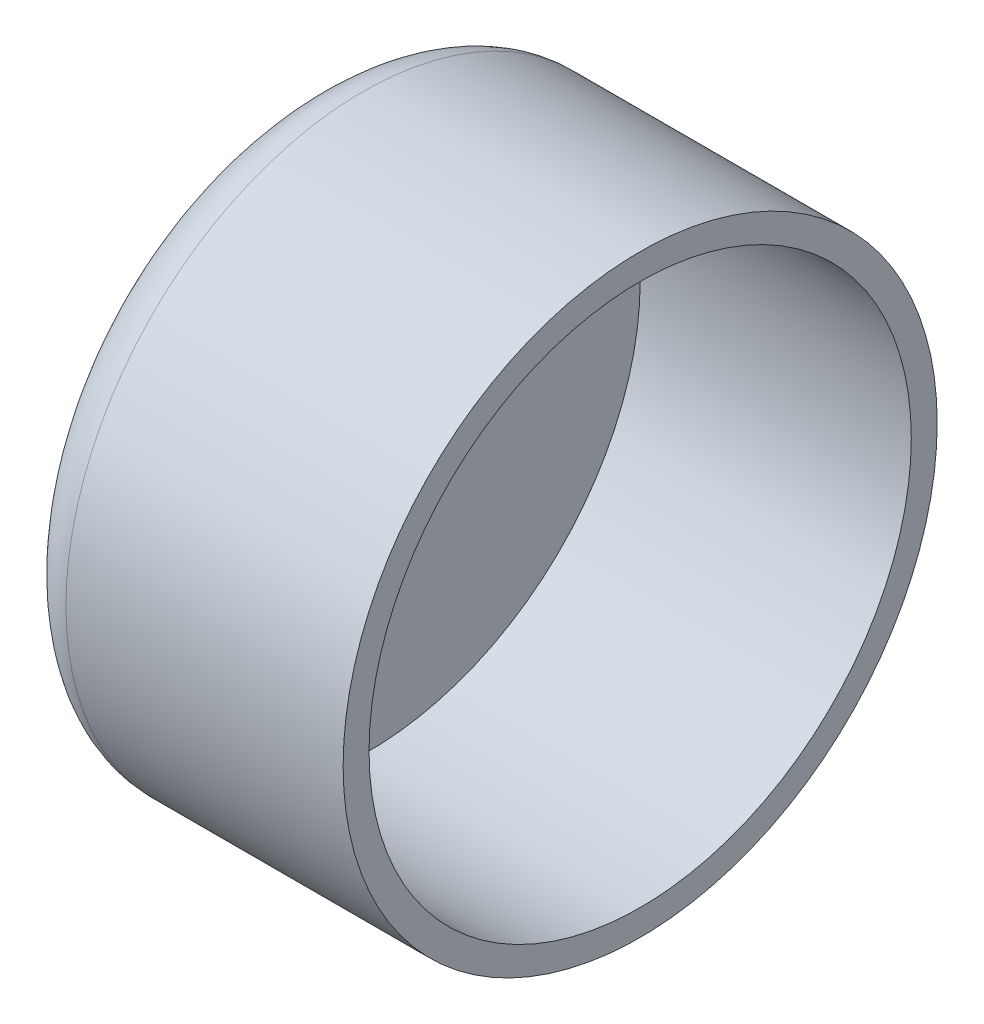
from build123d import *

# Parameters (mm, degrees)
SKETCH_1_R         = 49.3
SKETCH_1_R_2       = 45
EXTRUDE_1_DEPTH    = 45
SKETCH_2_R         = 49.3
EXTRUDE_1_2_DEPTH  = 1
DOME_1_FACE_RADIUS = 49.3
DOME_1_HEIGHT      = 18


with BuildPart() as part:
    # Эскиз1 → Extrude 1 (new body)
    with BuildSketch(Plane(origin=(0, 0, 0), x_dir=(0, 0, -1), z_dir=(1, 0, 0))):
        Circle(SKETCH_1_R)
        Circle(SKETCH_1_R_2, mode=Mode.SUBTRACT)
    extrude(amount=-EXTRUDE_1_DEPTH)

    # Эскиз2 → Extrude 1 2 (add)
    with BuildSketch(Plane.ZY.offset(45)):
        Circle(SKETCH_2_R)
    extrude(amount=EXTRUDE_1_2_DEPTH)

    # Купол1: an elliptical dome of height H over a round flat face of radius A is half a spheroid: the quarter ellipse of half axes A and H revolved about the face's axis
    with BuildSketch(Plane((-46, 0, 0), x_dir=(0, 0, -1), z_dir=(0, 1, 0)), mode=Mode.PRIVATE) as dome_1_quarter:
        Ellipse(DOME_1_FACE_RADIUS, DOME_1_HEIGHT)
        Rectangle(DOME_1_FACE_RADIUS, DOME_1_HEIGHT, align=(Align.MIN, Align.MIN), mode=Mode.INTERSECT)
    revolve(dome_1_quarter.sketch, axis=Axis((-46, 0, 0), (-1, 0, 0)))


solid = part.part
